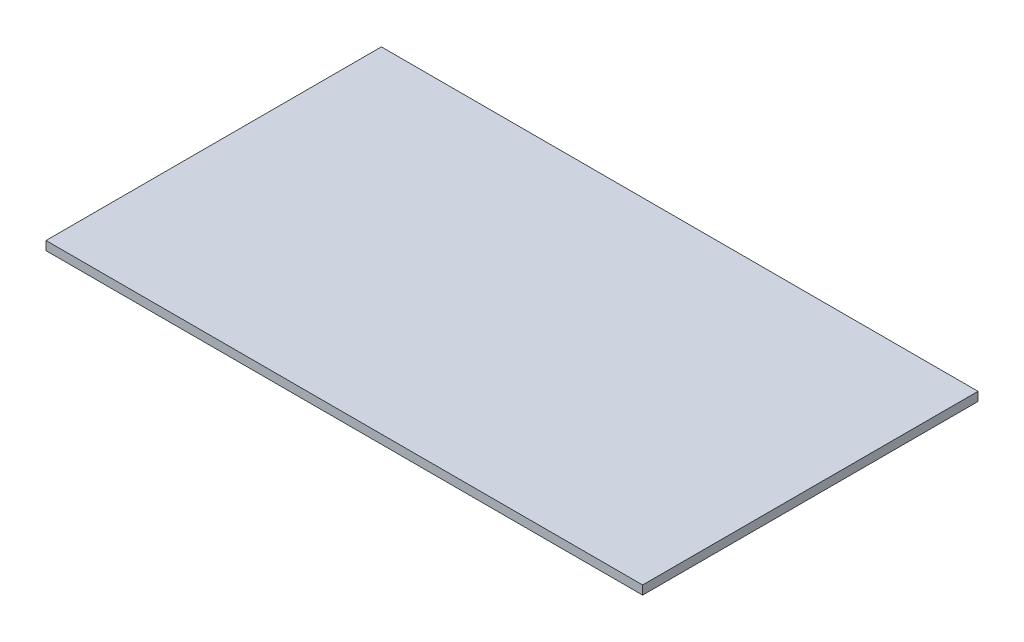
from build123d import *

# Parameters (mm, degrees)
SKETCH_1_W      = 338
SKETCH_1_H      = 190
EXTRUDE_1_DEPTH = 5


with BuildPart() as part:
    # 스케치1 → 보스-돌출1 (new body)
    with BuildSketch(Plane(origin=(0, 0, 0), x_dir=(1, 0, 0), z_dir=(0, 1, 0))):
        with Locations((169, 95)):
            Rectangle(SKETCH_1_W, SKETCH_1_H)
    extrude(amount=EXTRUDE_1_DEPTH)


solid = part.part
